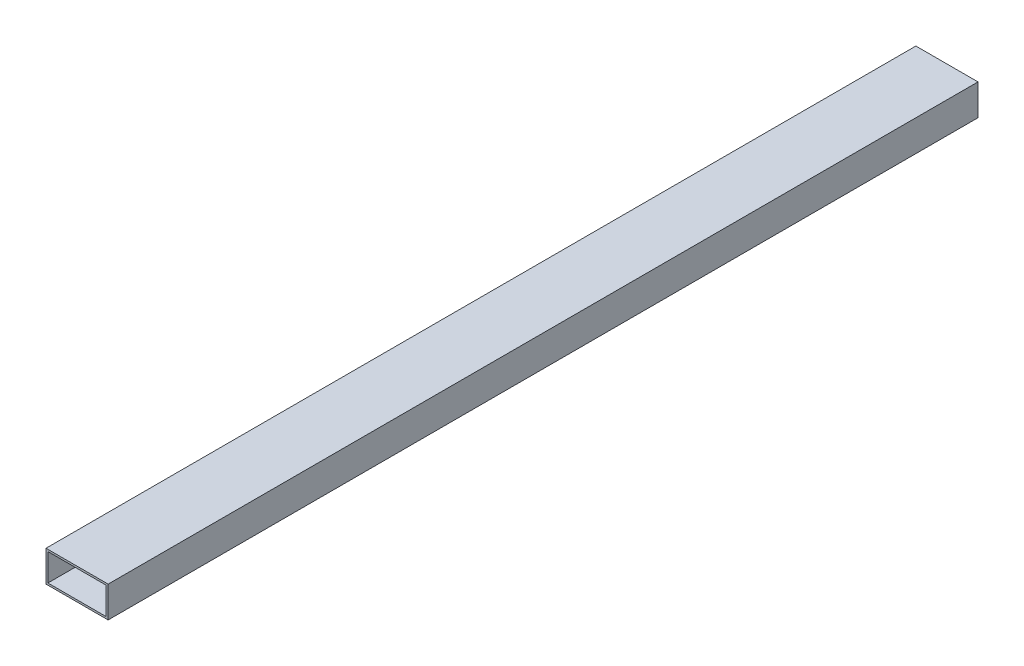
from build123d import *

# Parameters (mm, degrees)
SKETCH1_W           = 50.8
SKETCH1_H           = 25.4
SKETCH1_W_2         = 47.6504
SKETCH1_H_2         = 22.2504
EXTRUDE_THIN1_DEPTH = 711.2


with BuildPart() as part:
    # Sketch1 → Extrude-Thin1 (new body)
    with BuildSketch(Plane.XY):
        with Locations((-9.840837696, 11.569633508)):
            Rectangle(SKETCH1_W, SKETCH1_H)
        with Locations((-9.840837696, 11.569633508)):
            Rectangle(SKETCH1_W_2, SKETCH1_H_2, mode=Mode.SUBTRACT)
    extrude(amount=EXTRUDE_THIN1_DEPTH)


solid = part.part
